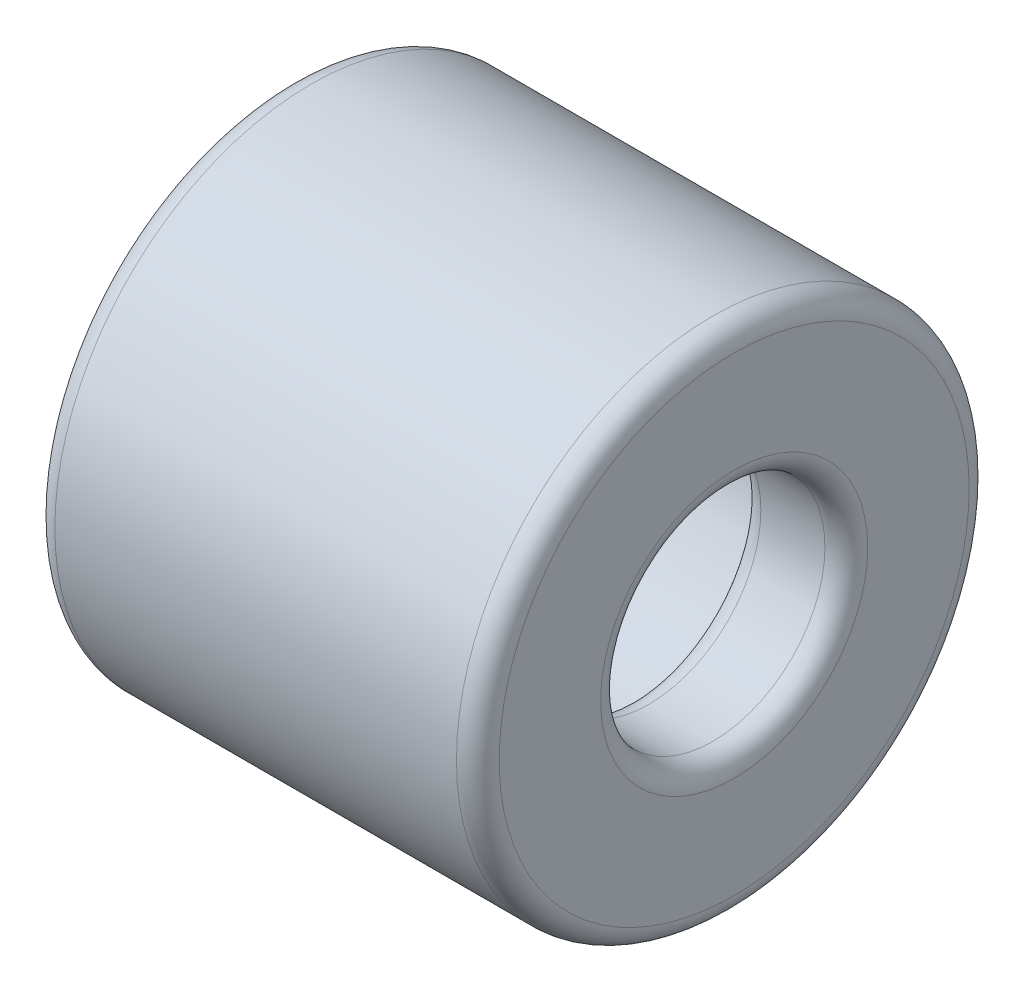
from build123d import *

# Parameters (mm, degrees)
CUT_EXTRUDE1_DEPTH      = 17.370705544
CUT_EXTRUDE1_DEPTH_BACK = 17.370705544
SKETCH2_R               = 2.625
FILLET1_R               = 0.5


with BuildPart() as part:
    # Sketch1 → Revolve1 (revolve)
    with BuildSketch(Plane.XY, mode=Mode.PRIVATE) as revolve1_sk:
        Polygon((11.5, 4.1), (3.6, 4.1), (3.6, 6), (14, 6), (14, 0), (11.5, 0), align=None)
    revolve(revolve1_sk.sketch.rotate(Axis((-1.174323487, 0, 0), (1, 0, 0)), 90), axis=Axis((-1.174323487, 0, 0), (1, 0, 0)))

    # Sketch2 → Cut-Extrude1 (cut, two sides: drawn at the far end of the back side and taken through both)
    with BuildSketch(Plane(origin=(0, 0, 0), x_dir=(0, 0, -1), z_dir=(1, 0, 0)).offset(-CUT_EXTRUDE1_DEPTH_BACK)):
        with Locations(Location((0, 0, 0), (0, 0, 180))):
            Circle(SKETCH2_R)
    extrude(amount=CUT_EXTRUDE1_DEPTH + CUT_EXTRUDE1_DEPTH_BACK, mode=Mode.SUBTRACT)

    # Fillet1
    fillet1_edges = [part.edges().sort_by_distance(p)[0] for p in [
        (11.5, 0, -2.625),
        (14, 0, -2.625),
        (3.6, 0, -4.1),
        (3.6, 0, -6),
        (14, 0, -6),
    ]]
    fillet(fillet1_edges, radius=FILLET1_R)


solid = part.part
